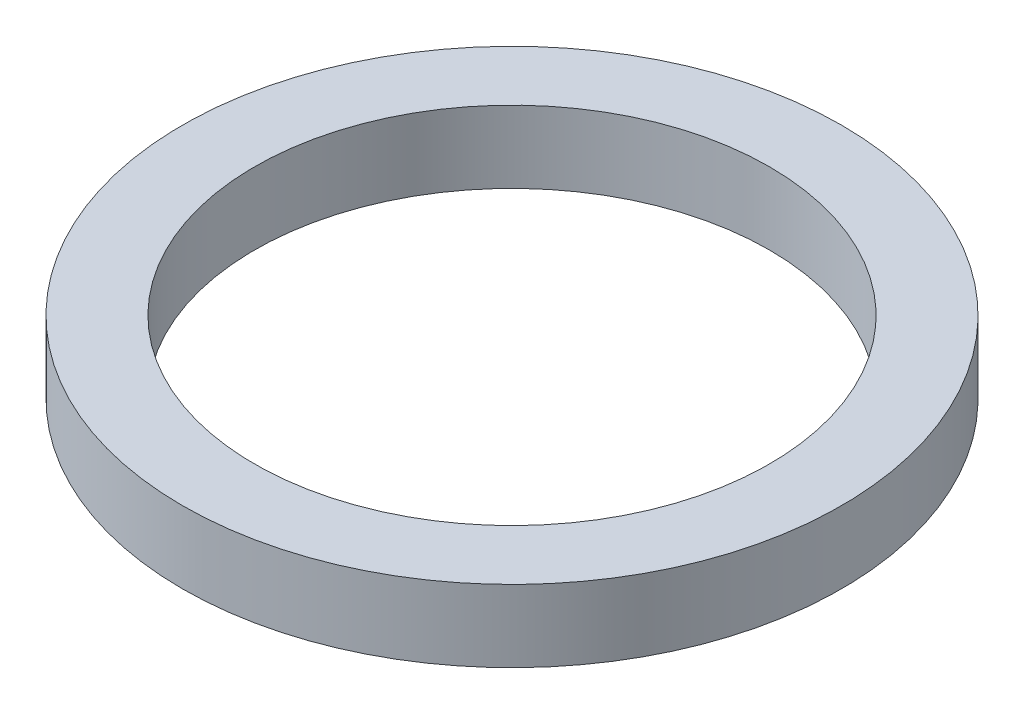
from build123d import *

# Parameters (mm, degrees)
ESQUISSE1_W = 3.5
ESQUISSE1_H = 3.5


with BuildPart() as part:
    # segment: sweep along a path in Esquisse2
    with BuildLine(Plane(origin=(0, 0, 0), x_dir=(1, 0, 0), z_dir=(0, 1, 0))) as segment_path:
        CenterArc((-16, 0), 16, 0, 360)
    # Esquisse1 → segment (sweep)
    with BuildSketch(Plane.XY):
        with Locations((-1.75, 1.75)):
            Rectangle(ESQUISSE1_W, ESQUISSE1_H)
    sweep(path=segment_path.line)


solid = part.part
